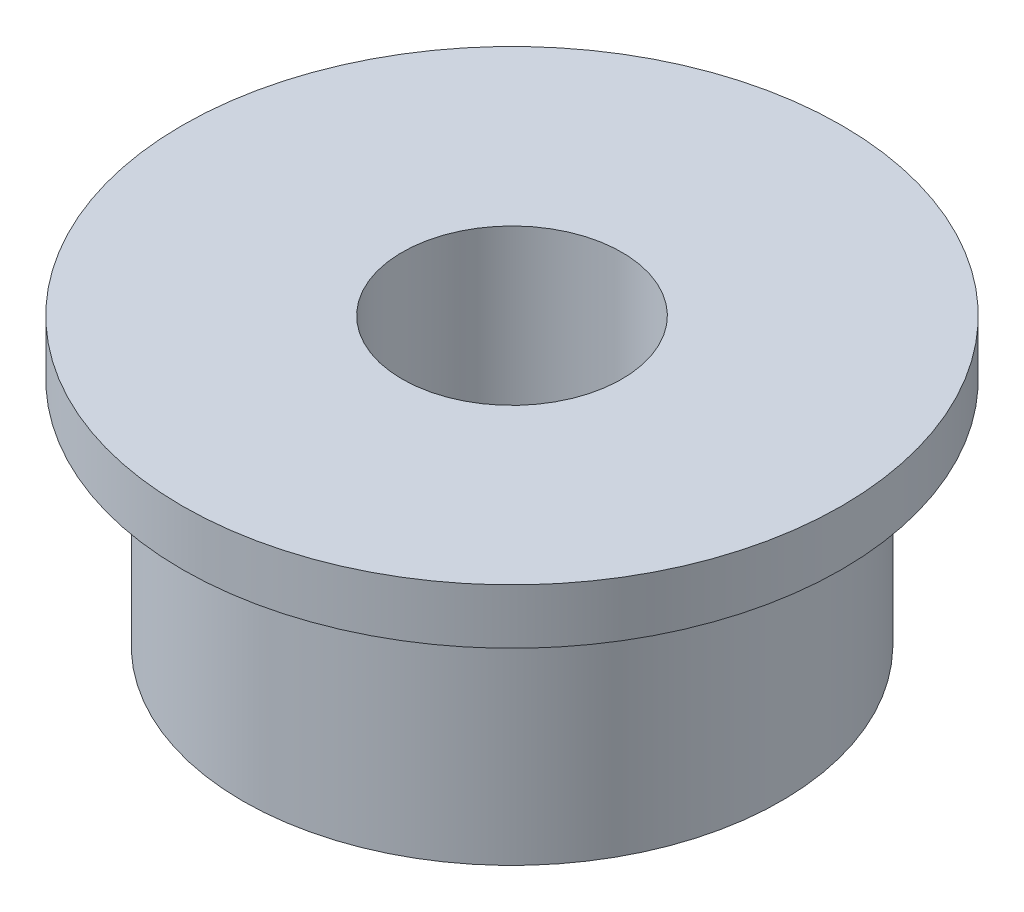
from build123d import *


with BuildPart() as part:
    # Sketch2 → Revolve1 (revolve)
    with BuildSketch(Plane(origin=(0, 0, 0), x_dir=(0, 0, -1), z_dir=(1, 0, 0))):
        Polygon((-12.25, -6.5), (-12.25, 4), (-15, 4), (-15, 6.5), (-5, 6.5), (-5, -6.5), align=None)
    revolve(axis=Axis((0, 22.453231344, 0), (0, -1, 0)))


solid = part.part
